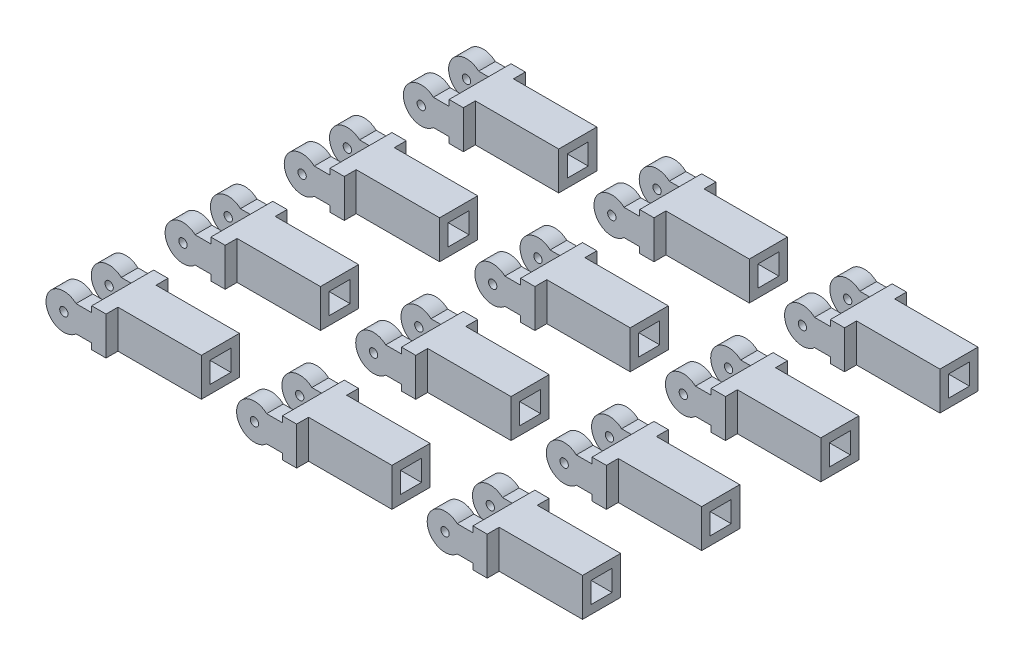
from build123d import *

# Parameters (mm, degrees)
SKETCH_1_W               = 3.2
SKETCH_1_H               = 3.2
SKETCH_1_W_2             = 1.76
SKETCH_1_H_2             = 1.76
EXTRUDE_1_DEPTH          = 7
SKETCH_2_W               = 3.2
SKETCH_2_H               = 3.2
EXTRUDE_2_DEPTH          = 1.2
EXTRUDE_3_DEPTH          = 2.6
CUT_EXTRUDE_1_DEPTH      = 1.2
SKETCH_5_W               = 5.2
SKETCH_5_H               = 3.2
EXTRUDE_4_DEPTH          = 1.2
CUT_EXTRUDE_2_DEPTH      = 9.124038405
CUT_EXTRUDE_2_DEPTH_BACK = 9.124038405
SKETCH_6_R               = 0.35
PATTERN_LINEAR_1_COUNT   = 4
PATTERN_LINEAR_1_PITCH   = 10
PATTERN_LINEAR_1_2_COUNT = 3
PATTERN_LINEAR_1_2_PITCH = 16


with BuildPart() as part:
    # 草图1 → 凸台-拉伸1 (new body)
    with BuildSketch(Plane(origin=(0, 0, 0), x_dir=(0, 0, -1), z_dir=(1, 0, 0))):
        Rectangle(SKETCH_1_W, SKETCH_1_H)
        Rectangle(SKETCH_1_W_2, SKETCH_1_H_2, mode=Mode.SUBTRACT)
    extrude(amount=EXTRUDE_1_DEPTH)

    # 草图2 → 凸台-拉伸2 (add)
    with BuildSketch(Plane.ZY):
        Rectangle(SKETCH_2_W, SKETCH_2_H)
    extrude(amount=EXTRUDE_2_DEPTH)

    # 草图3 → 凸台-拉伸3 (add, symmetric)
    with BuildSketch(Plane.XY):
        with BuildLine():
            Line((-1.2, -1.1), (-1.2, 1.1))
            Line((-1.2, 1.1), (-2.52, 1.1))
            ThreePointArc((-2.52, 1.1), (-2.165084685, 0.600122548), (-2.039803903, 0))
            ThreePointArc((-2.039803903, 0), (-2.165084685, -0.600122548), (-2.52, -1.1))
            Line((-2.52, -1.1), (-1.2, -1.1))
        make_face()
        with BuildLine():
            ThreePointArc((-2.039803903, 0), (-2.165084685, 0.600122548), (-2.52, 1.1))
            Line((-2.52, 1.1), (-2.52, -1.1))
            ThreePointArc((-2.52, -1.1), (-2.165084685, -0.600122548), (-2.039803903, 0))
        make_face()
        with BuildLine():
            Line((-2.52, -1.1), (-2.52, 1.1))
            ThreePointArc((-2.52, 1.1), (-5.039803903, 0), (-2.52, -1.1))
        make_face()
        with BuildLine():
            ThreePointArc((-2.039803903, 0), (-2.165084685, 0.600122548), (-2.52, 1.1))
            Line((-2.52, 1.1), (-2.52, -1.1))
            ThreePointArc((-2.52, -1.1), (-2.165084685, -0.600122548), (-2.039803903, 0))
        make_face()
        with BuildLine():
            Line((-2.52, -1.1), (-2.52, 1.1))
            ThreePointArc((-2.52, 1.1), (-5.039803903, 0), (-2.52, -1.1))
        make_face()
    extrude(amount=EXTRUDE_3_DEPTH, both=True)

    # 草图4 → 切除-拉伸1 (cut, symmetric)
    with BuildSketch(Plane.XY):
        with BuildLine():
            Line((-1.2, 1.1), (-2.52, 1.1))
            ThreePointArc((-2.52, 1.1), (-5.039803903, 0), (-2.52, -1.1))
            Line((-2.52, -1.1), (-1.2, -1.1))
            Line((-1.2, -1.1), (-1.2, 1.1))
        make_face()
    extrude(amount=CUT_EXTRUDE_1_DEPTH, both=True, mode=Mode.SUBTRACT)

    # 草图5 → 凸台-拉伸4 (add)
    with BuildSketch(Plane(origin=(-1.2, 0, 0), x_dir=(0, 0, -1), z_dir=(1, 0, 0))):
        Rectangle(SKETCH_5_W, SKETCH_5_H)
    extrude(amount=EXTRUDE_4_DEPTH)

    # 草图6 → 切除-拉伸2 (cut, two sides: drawn at the far end of the back side and taken through both)
    with BuildSketch(Plane(origin=(0, 0, 1.2), x_dir=(-1, 0, 0), z_dir=(0, 0, -1)).offset(-CUT_EXTRUDE_2_DEPTH_BACK)):
        with Locations((3.539803903, 0)):
            Circle(SKETCH_6_R)
    extrude(amount=CUT_EXTRUDE_2_DEPTH + CUT_EXTRUDE_2_DEPTH_BACK, mode=Mode.SUBTRACT)


with BuildPart() as pattern_linear_1_1:
    # 阵列(线性)1: pattern copy
    add(part.part.moved(Location(Vector(0, 0, 1) * (1 * PATTERN_LINEAR_1_PITCH))))


with BuildPart() as pattern_linear_1_2:
    # 阵列(线性)1: pattern copy
    add(part.part.moved(Location(Vector(0, 0, 1) * (2 * PATTERN_LINEAR_1_PITCH))))


with BuildPart() as pattern_linear_1_3:
    # 阵列(线性)1: pattern copy
    add(part.part.moved(Location(Vector(0, 0, 1) * (3 * PATTERN_LINEAR_1_PITCH))))


with BuildPart() as pattern_linear_1_2_1:
    # Pattern Linear 1 2: pattern copy
    add(part.part.moved(Location(Vector(1, 0, 0) * (1 * PATTERN_LINEAR_1_2_PITCH))))


with BuildPart() as pattern_linear_1_2_2:
    # Pattern Linear 1 2: pattern copy
    add(part.part.moved(Location(Vector(1, 0, 0) * (2 * PATTERN_LINEAR_1_2_PITCH))))


with BuildPart() as pattern_linear_1_2_3:
    # Pattern Linear 1 2: pattern copy
    add(pattern_linear_1_1.part.moved(Location(Vector(1, 0, 0) * (1 * PATTERN_LINEAR_1_2_PITCH))))


with BuildPart() as pattern_linear_1_2_4:
    # Pattern Linear 1 2: pattern copy
    add(pattern_linear_1_1.part.moved(Location(Vector(1, 0, 0) * (2 * PATTERN_LINEAR_1_2_PITCH))))


with BuildPart() as pattern_linear_1_2_5:
    # Pattern Linear 1 2: pattern copy
    add(pattern_linear_1_2.part.moved(Location(Vector(1, 0, 0) * (1 * PATTERN_LINEAR_1_2_PITCH))))


with BuildPart() as pattern_linear_1_2_6:
    # Pattern Linear 1 2: pattern copy
    add(pattern_linear_1_2.part.moved(Location(Vector(1, 0, 0) * (2 * PATTERN_LINEAR_1_2_PITCH))))


with BuildPart() as pattern_linear_1_2_7:
    # Pattern Linear 1 2: pattern copy
    add(pattern_linear_1_3.part.moved(Location(Vector(1, 0, 0) * (1 * PATTERN_LINEAR_1_2_PITCH))))


with BuildPart() as pattern_linear_1_2_8:
    # Pattern Linear 1 2: pattern copy
    add(pattern_linear_1_3.part.moved(Location(Vector(1, 0, 0) * (2 * PATTERN_LINEAR_1_2_PITCH))))


solid = Compound([part.part, pattern_linear_1_1.part, pattern_linear_1_2.part, pattern_linear_1_3.part, pattern_linear_1_2_1.part, pattern_linear_1_2_2.part, pattern_linear_1_2_3.part, pattern_linear_1_2_4.part, pattern_linear_1_2_5.part, pattern_linear_1_2_6.part, pattern_linear_1_2_7.part, pattern_linear_1_2_8.part])
